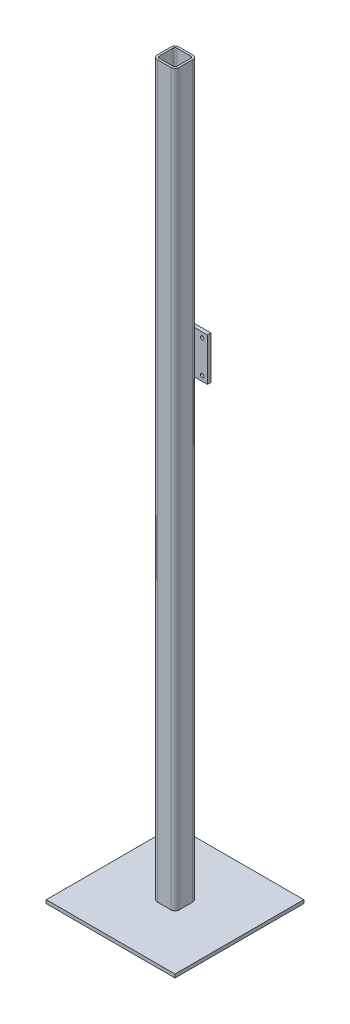
from build123d import *

# Parameters (mm, degrees)
RURA_CIENKO_CIENNA_KWADRATOWA_TS2X2X0_18_DEPTH = 1700
SZKIC5_W                                       = 300
SZKIC5_H                                       = 300
DODANIE_WYCI_GNI_CIE1_DEPTH                    = 8
SZKIC6_W                                       = 100
SZKIC6_H                                       = 100
SZKIC6_R                                       = 4.1
DODANIE_WYCI_GNI_CIE2_DEPTH                    = 8


with BuildPart() as part:
    # Sketch12 → Rura cienkościenna kwadratowa TS2X2X0.1875(1) (new body)
    with BuildSketch(Plane(origin=(0, 0, 0), x_dir=(1, 0, 0), z_dir=(0, 1, 0))):
        with BuildLine():
            Line((-15.875, -25.4), (15.875, -25.4))
            ThreePointArc((15.875, -25.4), (22.610192091, -22.610192091), (25.4, -15.875))
            Line((25.4, -15.875), (25.4, 15.875))
            ThreePointArc((25.4, 15.875), (22.610192091, 22.610192091), (15.875, 25.4))
            Line((15.875, 25.4), (-15.875, 25.4))
            ThreePointArc((-15.875, 25.4), (-22.610192091, 22.610192091), (-25.4, 15.875))
            Line((-25.4, 15.875), (-25.4, -15.875))
            ThreePointArc((-25.4, -15.875), (-22.610192091, -22.610192091), (-15.875, -25.4))
        make_face()
        with BuildLine():
            Line((-15.875, -20.6375), (15.875, -20.6375))
            ThreePointArc((15.875, -20.6375), (19.242596045, -19.242596045), (20.6375, -15.875))
            Line((20.6375, -15.875), (20.6375, 15.875))
            ThreePointArc((20.6375, 15.875), (19.242596045, 19.242596045), (15.875, 20.6375))
            Line((15.875, 20.6375), (-15.875, 20.6375))
            ThreePointArc((-15.875, 20.6375), (-19.242596045, 19.242596045), (-20.6375, 15.875))
            Line((-20.6375, 15.875), (-20.6375, -15.875))
            ThreePointArc((-20.6375, -15.875), (-19.242596045, -19.242596045), (-15.875, -20.6375))
        make_face(mode=Mode.SUBTRACT)
    extrude(amount=RURA_CIENKO_CIENNA_KWADRATOWA_TS2X2X0_18_DEPTH)


with BuildPart() as body_2:
    # Szkic5 → Dodanie-wyciągnięcie1 (new body)
    with BuildSketch(Plane.XZ):
        Rectangle(SZKIC5_W, SZKIC5_H)
    extrude(amount=DODANIE_WYCI_GNI_CIE1_DEPTH)


with BuildPart() as body_3:
    # Szkic6 → Dodanie-wyciągnięcie2 (new body)
    with BuildSketch(Plane(origin=(0, 0, -25.4), x_dir=(-1, 0, 0), z_dir=(0, 0, -1))):
        with Locations((0, 1102)):
            Rectangle(SZKIC6_W, SZKIC6_H)
        with Locations((-38, 1140)):
            Circle(SZKIC6_R, mode=Mode.SUBTRACT)
        with Locations((38, 1140)):
            Circle(SZKIC6_R, mode=Mode.SUBTRACT)
        with Locations((38, 1064)):
            Circle(SZKIC6_R, mode=Mode.SUBTRACT)
        with Locations((-38, 1064)):
            Circle(SZKIC6_R, mode=Mode.SUBTRACT)
    extrude(amount=DODANIE_WYCI_GNI_CIE2_DEPTH)


solid = Compound([part.part, body_2.part, body_3.part])
